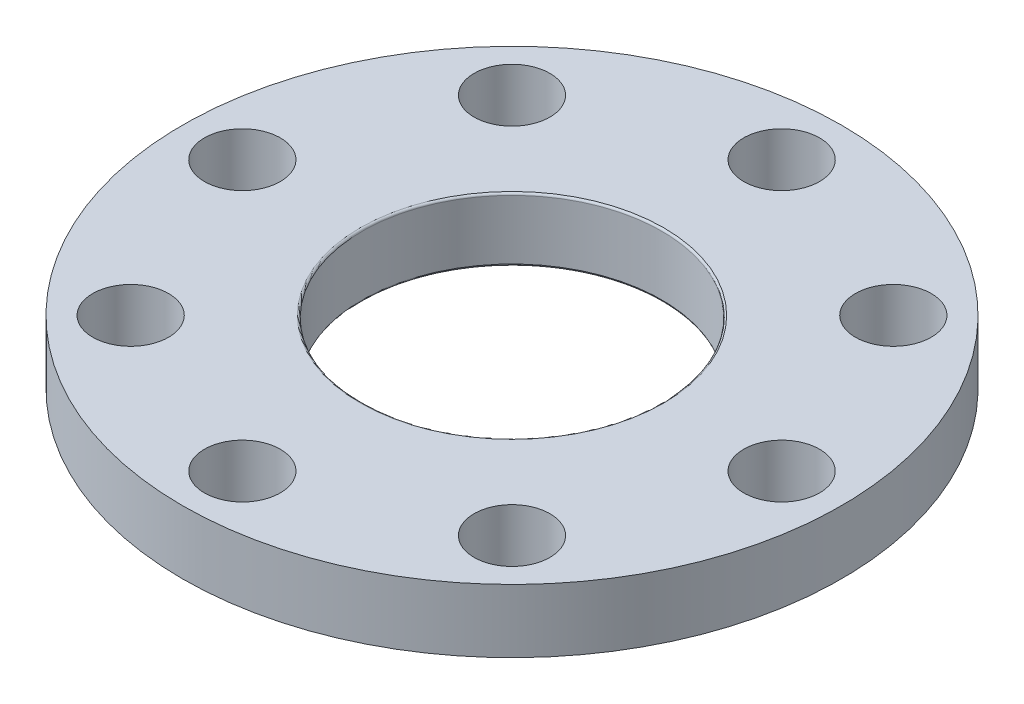
from build123d import *

# Parameters (mm, degrees)
SKETCH1_R           = 16.5
SKETCH1_R_2         = 7.5
BOSS_EXTRUDE1_DEPTH = 3.175
FILLET1_R           = 0.1
SKETCH2_R           = 1.89865
CUT_EXTRUDE1_DEPTH  = 24.549535558
CIRPATTERN1_COUNT   = 8


with BuildPart() as part:
    # Sketch1 → Boss-Extrude1 (new body)
    with BuildSketch(Plane(origin=(0, 0, 0), x_dir=(1, 0, 0), z_dir=(0, 1, 0))):
        with Locations(Location((0, 0, 0), (0, 0, 270))):
            Circle(SKETCH1_R)
        with Locations(Location((0, 0, 0), (0, 0, 270))):
            Circle(SKETCH1_R_2, mode=Mode.SUBTRACT)
    extrude(amount=BOSS_EXTRUDE1_DEPTH)

    # Fillet1
    fillet1_edges = [part.edges().sort_by_distance(p)[0] for p in [
        (0, 0, -7.5),
        (0, 3.175, -7.5),
    ]]
    fillet(fillet1_edges, radius=FILLET1_R)

    # Sketch2 → Cut-Extrude1 (cut, through all)
    with BuildSketch(Plane(origin=(0, 3.175, 0), x_dir=(-1, 0, 0), z_dir=(0, 1, 0))):
        with Locations(Location((0, -13.5, 0), (0, 0, 90))):
            Circle(SKETCH2_R)
    cut_extrude1 = extrude(amount=-CUT_EXTRUDE1_DEPTH, mode=Mode.SUBTRACT)

    # CirPattern1: Cut-Extrude1 ×8 about axis
    cirpattern1_axis = Axis((0, 0, 0), (0, 1, 0))
    for i in range(1, CIRPATTERN1_COUNT):
        add(cut_extrude1.rotate(cirpattern1_axis, i * 360 / CIRPATTERN1_COUNT), mode=Mode.SUBTRACT)


solid = part.part
